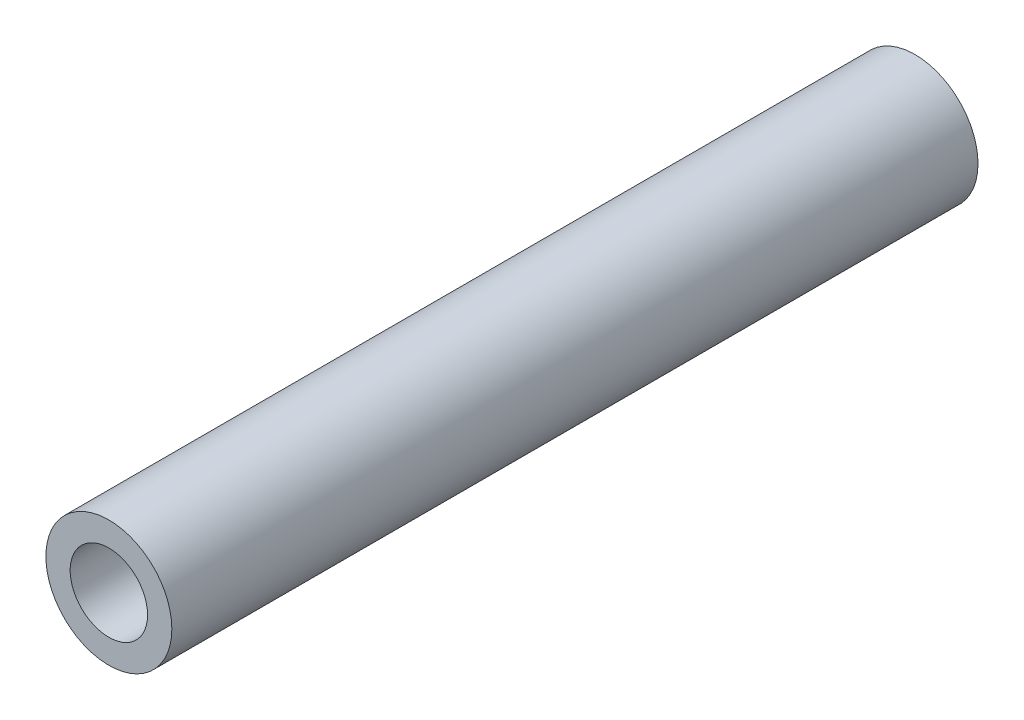
from build123d import *

# Parameters (mm, degrees)
SKETCH1_R      = 3.96875
SKETCH1_R_2    = 2.4384
EXTRUDE1_DEPTH = 25.4


with BuildPart() as part:
    # Sketch1 → Extrude1 (new, symmetric)
    with BuildSketch(Plane.XY):
        Circle(SKETCH1_R)
        Circle(SKETCH1_R_2, mode=Mode.SUBTRACT)
    extrude(amount=EXTRUDE1_DEPTH, both=True)


solid = part.part
